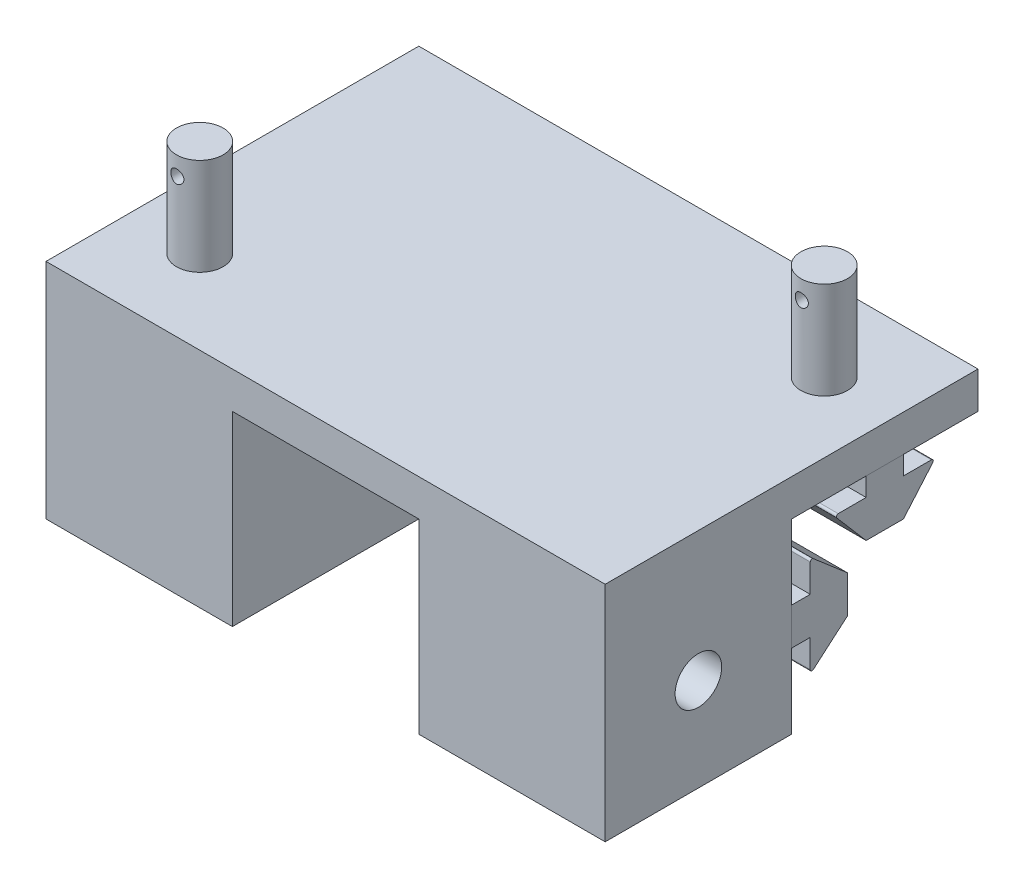
from build123d import *

# Parameters (mm, degrees)
SKETCH1_W                        = 76.2
SKETCH1_H                        = 50.8
BOSS_EXTRUDE1_DEPTH              = 5
SKETCH6_W                        = 25.4
SKETCH6_H                        = 25.4
BOSS_EXTRUDE2_DEPTH              = 25.4
F_1_4_0_25_DIAMETER_HOLE1_REACH  = 86.242
F_1_4_0_25_DIAMETER_HOLE1_BORE_R = 3.175
SKETCH10_W                       = 2.54
SKETCH10_H                       = 5.08
SKETCH10_W_2                     = 5.08
SKETCH10_H_2                     = 2.54
BOSS_EXTRUDE3_DEPTH              = 76.2
SKETCH11_W                       = 25.4
SKETCH11_H                       = 25.4
CUT_EXTRUDE2_DEPTH               = 50.8
SKETCH17_R                       = 3.175
BOSS_EXTRUDE4_DEPTH              = 13.208
SKETCH18_R                       = 0.889
CUT_EXTRUDE3_DEPTH               = 69.391593051


with BuildPart() as part:
    # Sketch1 → Boss-Extrude1 (new body)
    with BuildSketch(Plane(origin=(0, 0, 0), x_dir=(1, 0, 0), z_dir=(0, 1, 0))):
        Rectangle(SKETCH1_W, SKETCH1_H)
    extrude(amount=BOSS_EXTRUDE1_DEPTH)

    # Sketch6 → Boss-Extrude2 (add)
    with BuildSketch(Plane.XZ):
        with Locations((-25.4, 12.7)):
            Rectangle(SKETCH6_W, SKETCH6_H)
        with Locations((25.4, 12.7)):
            Rectangle(SKETCH6_W, SKETCH6_H)
    extrude(amount=BOSS_EXTRUDE2_DEPTH)

    # 1/4 (0.25) Diameter Hole1 bore → 1/4 (0.25) Diameter Hole1 (cut, up to next)
    with BuildSketch(Plane(origin=(38.1, 0, 0), x_dir=(0, 0, -1), z_dir=(1, 0, 0)), mode=Mode.PRIVATE) as f_1_4_0_25_diameter_hole1_sk1:
        with Locations((-12.7, -12.7)):
            Circle(F_1_4_0_25_DIAMETER_HOLE1_BORE_R)
    f_1_4_0_25_diameter_hole1_tool1 = extrude(f_1_4_0_25_diameter_hole1_sk1.sketch, amount=-F_1_4_0_25_DIAMETER_HOLE1_REACH, mode=Mode.PRIVATE) & part.part
    add(f_1_4_0_25_diameter_hole1_tool1.solids().sort_by_distance((38.1, -12.7, 12.7))[0], mode=Mode.SUBTRACT)

    # Sketch17 → Boss-Extrude4 (add)
    with BuildSketch(Plane(origin=(0, 5, 0), x_dir=(1, 0, 0), z_dir=(0, 1, 0))):
        with Locations(Location((-28.575, -13.97, 0), (0, 0, 90))):
            Circle(SKETCH17_R)
        with Locations(Location((28.575, 13.97, 0), (0, 0, 90))):
            Circle(SKETCH17_R)
    extrude(amount=BOSS_EXTRUDE4_DEPTH)

    # Sketch18 → Cut-Extrude3 (cut, through all)
    with BuildSketch(Plane(origin=(0, 0, -25.4), x_dir=(-1, 0, 0), z_dir=(0, 0, -1))):
        with Locations((-28.575, 15.668)):
            Circle(SKETCH18_R)
        with Locations((28.575, 15.668)):
            Circle(SKETCH18_R)
    extrude(amount=-CUT_EXTRUDE3_DEPTH, mode=Mode.SUBTRACT)


with BuildPart() as body_2:
    # Sketch10 → Boss-Extrude3 (new body)
    with BuildSketch(Plane(origin=(38.1, 0, 0), x_dir=(0, 0, -1), z_dir=(1, 0, 0))):
        with Locations((1.27, -12.7)):
            Rectangle(SKETCH10_W, SKETCH10_H)
        with BuildLine():
            Line((7.62, -10.16), (2.959490795, -6.157311659))
            ThreePointArc((2.959490795, -6.157311659), (2.687977979, -6.119185505), (2.54, -6.35))
            Line((2.54, -6.35), (2.54, -19.05))
            ThreePointArc((2.54, -19.05), (2.687977979, -19.280814495), (2.959490795, -19.242688341))
            Line((2.959490795, -19.242688341), (7.62, -15.24))
            Line((7.62, -15.24), (7.62, -10.16))
        make_face()
        with BuildLine():
            Line((19.05, -2.54), (6.35, -2.54))
            ThreePointArc((6.35, -2.54), (6.119185505, -2.687977979), (6.157311659, -2.959490795))
            Line((6.157311659, -2.959490795), (10.16, -7.62))
            Line((10.16, -7.62), (15.24, -7.62))
            Line((15.24, -7.62), (19.242688341, -2.959490795))
            ThreePointArc((19.242688341, -2.959490795), (19.280814495, -2.687977979), (19.05, -2.54))
        make_face()
        with Locations((12.7, -1.27)):
            Rectangle(SKETCH10_W_2, SKETCH10_H_2)
    extrude(amount=-BOSS_EXTRUDE3_DEPTH)

    # Sketch11 → Cut-Extrude2 (cut)
    with BuildSketch(Plane.XY.offset(25.4)):
        with Locations((0, -12.7)):
            Rectangle(SKETCH11_W, SKETCH11_H)
    extrude(amount=-CUT_EXTRUDE2_DEPTH, mode=Mode.SUBTRACT)


solid = Compound([part.part, body_2.part])
